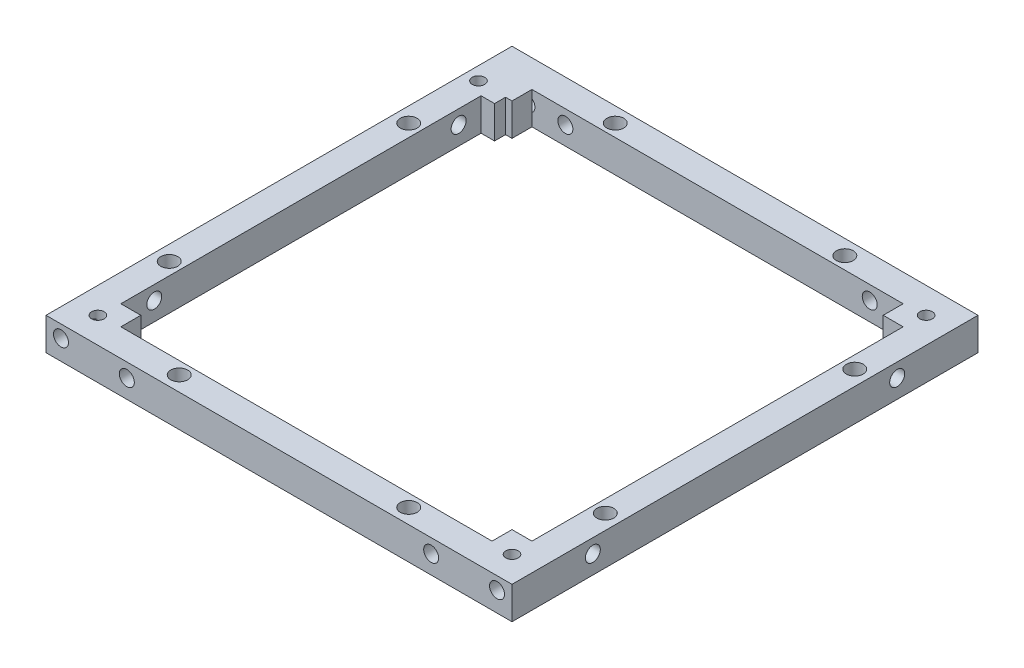
from build123d import *

# Parameters (mm, degrees)
SKETCH1_W                       = 93.4
SKETCH1_H                       = 93.4
SKETCH1_W_2                     = 77.4
SKETCH1_H_2                     = 77.4
BOSS_EXTRUDE1_DEPTH             = 8
F_3_0_3_DIAMETER_HOLE6_D        = 3
F_3_0_3_DIAMETER_HOLE6_DEPTH    = 7.5
F_3_0_3_DIAMETER_HOLE3_D        = 3
F_3_0_3_DIAMETER_HOLE3_DEPTH    = 7.5
SKETCH27_W                      = 79.4
SKETCH27_H                      = 79.4
CUT_EXTRUDE2_DEPTH              = 10
F_3_4_3_4_DIAMETER_HOLE1_D      = 3.4
SKETCH38_W                      = 82.4
SKETCH38_H                      = 82.4
CUT_EXTRUDE4_DEPTH              = 10
SKETCH44_W                      = 4
SKETCH44_H                      = 4
BOSS_EXTRUDE2_DEPTH             = 8
SKETCH45_W                      = 4
SKETCH45_H                      = 3.5
BOSS_EXTRUDE3_DEPTH             = 8
TAP_DRILL_FOR_M3X0_5_TAP1_D     = 2.5
SKETCH49_W                      = 93.4
SKETCH49_H                      = 1.5
CUT_EXTRUDE5_DEPTH              = 146
TAP_DRILL_FOR_M3X0_5_TAP2_D     = 3
TAP_DRILL_FOR_M3X0_5_TAP2_DEPTH = 5.5
TAP_DRILL_FOR_M3X0_5_TAP3_D     = 3
TAP_DRILL_FOR_M3X0_5_TAP3_DEPTH = 5.5
TAP_DRILL_FOR_M3X0_5_TAP4_D     = 3
TAP_DRILL_FOR_M3X0_5_TAP5_D     = 3
TAP_DRILL_FOR_M3X0_5_TAP6_D     = 3
TAP_DRILL_FOR_M3X0_5_TAP6_DEPTH = 5.5


with BuildPart() as part:
    # Sketch1 → Boss-Extrude1 (new body)
    with BuildSketch(Plane(origin=(0, 0, 0), x_dir=(1, 0, 0), z_dir=(0, 1, 0))):
        Rectangle(SKETCH1_W, SKETCH1_H)
        Rectangle(SKETCH1_W_2, SKETCH1_H_2, mode=Mode.SUBTRACT)
    extrude(amount=BOSS_EXTRUDE1_DEPTH)

    # Ø3.0 (3) Diameter Hole6
    with Locations(Plane.XY.offset(46.7)):
        with Locations((43.7, 4), (-43.7, 4)):
            Hole(F_3_0_3_DIAMETER_HOLE6_D / 2, depth=F_3_0_3_DIAMETER_HOLE6_DEPTH)

    # Ø3.0 (3) Diameter Hole3
    with Locations(Plane(origin=(0, 0, -46.7), x_dir=(-1, 0, 0), z_dir=(0, 0, -1))):
        with Locations((-43.7, 4), (43.7, 4)):
            Hole(F_3_0_3_DIAMETER_HOLE3_D / 2, depth=F_3_0_3_DIAMETER_HOLE3_DEPTH)

    # Sketch27 → Cut-Extrude2 (cut)
    with BuildSketch(Plane(origin=(0, 8, 0), x_dir=(1, 0, 0), z_dir=(0, 1, 0))):
        Rectangle(SKETCH27_W, SKETCH27_H)
    extrude(amount=-CUT_EXTRUDE2_DEPTH, mode=Mode.SUBTRACT)

    # Ø3.4 (3.4) Diameter Hole1 (through all)
    with Locations(Plane(origin=(0, 0, 0), x_dir=(-1, 0, 0), z_dir=(0, -1, 0))):
        with Locations((-23, 43.7), (23, 43.7), (43.7, 23), (43.7, -25), (23, -43.7), (-23, -43.7), (-43.7, -25), (-43.7, 25)):
            Hole(F_3_4_3_4_DIAMETER_HOLE1_D / 2)

    # Sketch38 → Cut-Extrude4 (cut)
    with BuildSketch(Plane(origin=(0, 8, 0), x_dir=(1, 0, 0), z_dir=(0, 1, 0))):
        Rectangle(SKETCH38_W, SKETCH38_H)
    extrude(amount=-CUT_EXTRUDE4_DEPTH, mode=Mode.SUBTRACT)

    # Sketch44 → Boss-Extrude2 (add)
    with BuildSketch(Plane.XZ):
        with Locations((39.2, -39.2)):
            Rectangle(SKETCH44_W, SKETCH44_H)
        with Locations((-39.2, -39.2)):
            Rectangle(SKETCH44_W, SKETCH44_H)
        with Locations((-39.2, 39.2)):
            Rectangle(SKETCH44_W, SKETCH44_H)
        with Locations((39.2, 39.2)):
            Rectangle(SKETCH44_W, SKETCH44_H)
    extrude(amount=-BOSS_EXTRUDE2_DEPTH)

    # Sketch45 → Boss-Extrude3 (add)
    with BuildSketch(Plane(origin=(0, 8, 0), x_dir=(1, 0, 0), z_dir=(0, 1, 0))):
        with Locations((-40.5, 36.75)):
            Rectangle(SKETCH45_W, SKETCH45_H)
    extrude(amount=-BOSS_EXTRUDE3_DEPTH)

    # Tap Drill for M3x0.5 Tap1 (through all)
    with Locations(Plane(origin=(0, 8, 0), x_dir=(1, 0, 0), z_dir=(0, 1, 0))):
        with Locations((41.5, 41.5), (41.5, -41.5), (-41.5, -41.5), (-44.05, 37.33)):
            Hole(TAP_DRILL_FOR_M3X0_5_TAP1_D / 2)

    # Sketch49 → Cut-Extrude5 (cut)
    with BuildSketch(Plane(origin=(46.7, 0, 0), x_dir=(0, 0, -1), z_dir=(1, 0, 0))):
        with Locations((0, 7.25)):
            Rectangle(SKETCH49_W, SKETCH49_H)
    extrude(amount=-CUT_EXTRUDE5_DEPTH, mode=Mode.SUBTRACT)

    # Tap Drill for M3x0.5 Tap2
    with Locations(Plane.ZY.offset(46.7)):
        with Locations((30.5, 3.7), (-30.5, 3.7)):
            Hole(TAP_DRILL_FOR_M3X0_5_TAP2_D / 2, depth=TAP_DRILL_FOR_M3X0_5_TAP2_DEPTH)

    # Tap Drill for M3x0.5 Tap3
    with Locations(Plane(origin=(0, 0, -46.7), x_dir=(-1, 0, 0), z_dir=(0, 0, -1))):
        with Locations((30.5, 3.7), (-30.5, 3.7)):
            Hole(TAP_DRILL_FOR_M3X0_5_TAP3_D / 2, depth=TAP_DRILL_FOR_M3X0_5_TAP3_DEPTH)

    # Tap Drill for M3x0.5 Tap4 (through all)
    with Locations(Plane(origin=(46.7, 0, 0), x_dir=(0, 0, -1), z_dir=(1, 0, 0))):
        with Locations((30.5, 3.7), (-30.5, 3.7)):
            Hole(TAP_DRILL_FOR_M3X0_5_TAP4_D / 2)

    # Tap Drill for M3x0.5 Tap5 (through all)
    with Locations(Plane.XY.offset(46.7)):
        with Locations((30.5, 3.7), (-30.5, 3.7)):
            Hole(TAP_DRILL_FOR_M3X0_5_TAP5_D / 2)

    # Tap Drill for M3x0.5 Tap6
    with Locations(Plane(origin=(0, 0, -46.7), x_dir=(-1, 0, 0), z_dir=(0, 0, -1))):
        with Locations((38.1, 3.7), (-38.1, 3.7)):
            Hole(TAP_DRILL_FOR_M3X0_5_TAP6_D / 2, depth=TAP_DRILL_FOR_M3X0_5_TAP6_DEPTH)


solid = part.part
